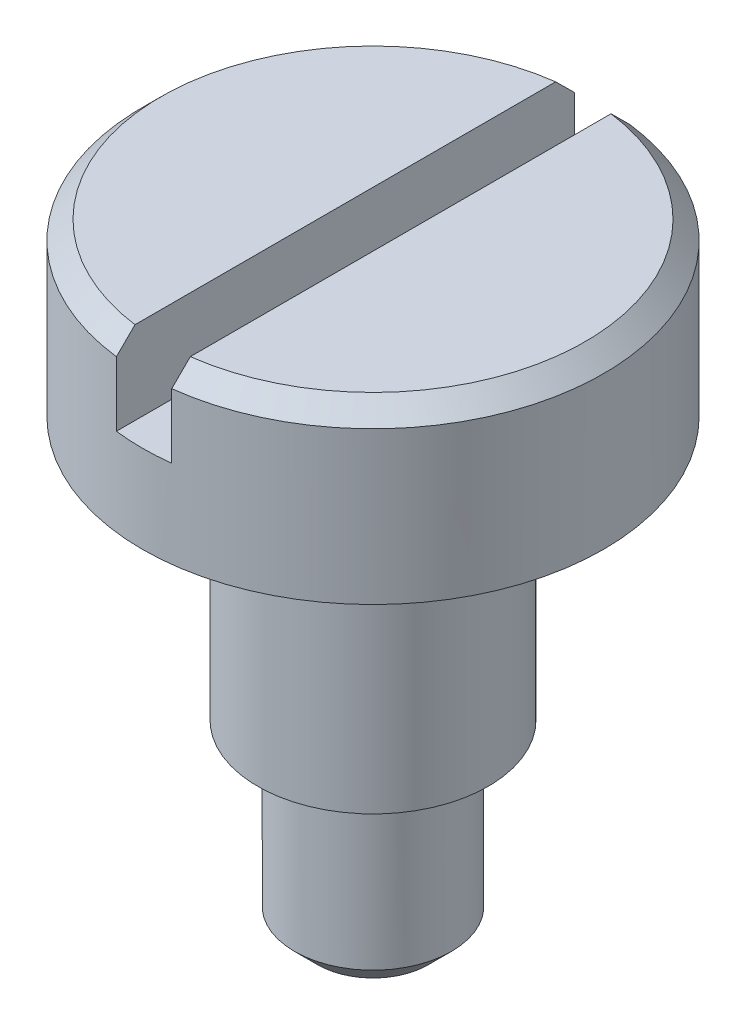
from build123d import *

# Parameters (mm, degrees)
SKETCH1_R               = 2.5
BOSS_EXTRUDE1_DEPTH     = 6.7
SKETCH2_OUTSIDE_W       = 8.948
SKETCH2_OUTSIDE_H       = 8.948
SKETCH2_OUTSIDE_R       = 0.85
CUT_EXTRUDE1_DEPTH      = 2
SKETCH3_OUTSIDE_W       = 8.948
SKETCH3_OUTSIDE_H       = 8.948
SKETCH3_OUTSIDE_R       = 1.25
CUT_EXTRUDE2_DEPTH      = 2.85
CHAMFER1_SIZE           = 0.2
CUT_EXTRUDE3_DEPTH      = 8.575618787
CUT_EXTRUDE3_DEPTH_BACK = 8.575618787
SKETCH4_W               = 0.6
SKETCH4_H               = 0.9
CHAMFER2_SIZE           = 0.25


with BuildPart() as part:
    # Sketch1 → Boss-Extrude1 (new body)
    with BuildSketch(Plane(origin=(0, 0, 0), x_dir=(1, 0, 0), z_dir=(0, 1, 0))):
        with Locations(Location((0, 0, 0), (0, 0, 270))):
            Circle(SKETCH1_R)
    extrude(amount=BOSS_EXTRUDE1_DEPTH)

    # Sketch2 outside → Cut-Extrude1 (cut)
    with BuildSketch(Plane.XZ):
        Rectangle(SKETCH2_OUTSIDE_W, SKETCH2_OUTSIDE_H)
        with Locations(Location((0, 0, 0), (0, 0, 270))):
            Circle(SKETCH2_OUTSIDE_R, mode=Mode.SUBTRACT)
    extrude(amount=-CUT_EXTRUDE1_DEPTH, mode=Mode.SUBTRACT)

    # Sketch3 outside → Cut-Extrude2 (cut)
    with BuildSketch(Plane.XZ.offset(-2)):
        Rectangle(SKETCH3_OUTSIDE_W, SKETCH3_OUTSIDE_H)
        with Locations(Location((0, 0, 0), (0, 0, 270))):
            Circle(SKETCH3_OUTSIDE_R, mode=Mode.SUBTRACT)
    extrude(amount=-CUT_EXTRUDE2_DEPTH, mode=Mode.SUBTRACT)

    # Chamfer1
    chamfer1_edges = [part.edges().sort_by_distance(p)[0] for p in [
        (0, 6.7, -2.5),
    ]]
    chamfer(chamfer1_edges, length=CHAMFER1_SIZE)

    # Sketch4 → Cut-Extrude3 (cut, two sides: drawn at the far end of the back side and taken through both)
    with BuildSketch(Plane.XY.offset(-CUT_EXTRUDE3_DEPTH_BACK)):
        with Locations((0, 6.25)):
            Rectangle(SKETCH4_W, SKETCH4_H)
    extrude(amount=CUT_EXTRUDE3_DEPTH + CUT_EXTRUDE3_DEPTH_BACK, mode=Mode.SUBTRACT)

    # Chamfer2
    chamfer2_edges = [part.edges().sort_by_distance(p)[0] for p in [
        (0, 0, 0.85),
    ]]
    chamfer(chamfer2_edges, length=CHAMFER2_SIZE)


solid = part.part
